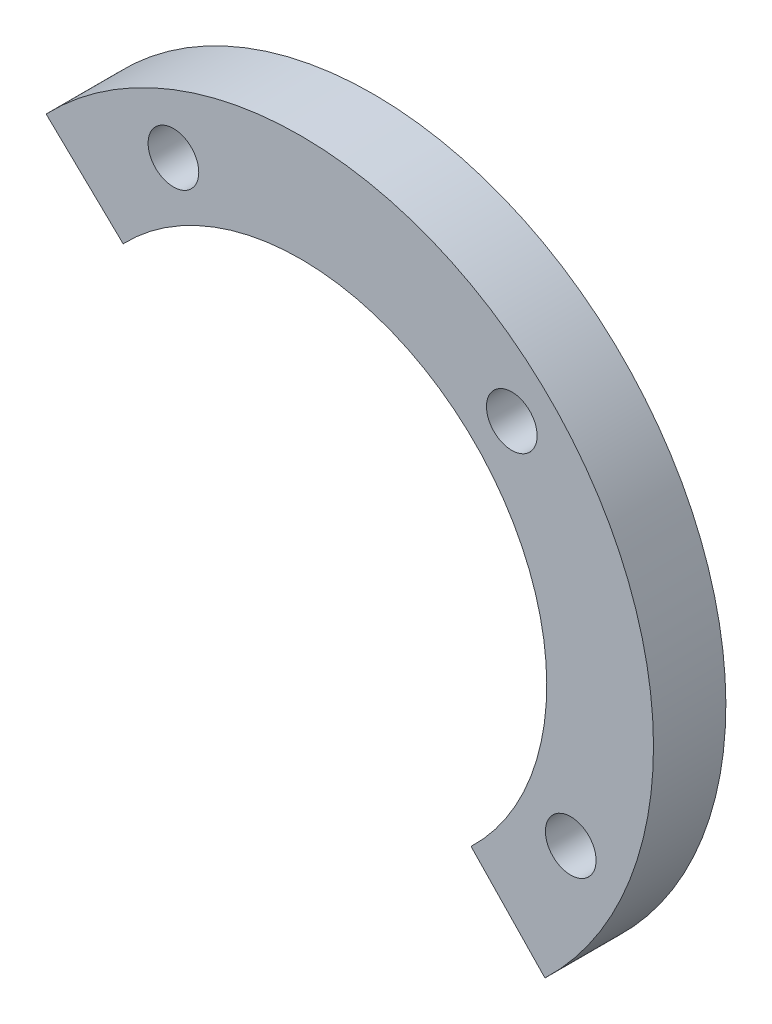
from build123d import *

# Parameters (mm, degrees)
SKETCH1_R      = 1.4
SHAPE_DEPTH    = 4
SKETCH2_R      = 1
NUT_CUTS_DEPTH = 2


with BuildPart() as part:
    # Sketch1 → Shape (new body)
    with BuildSketch(Plane.XY):
        with BuildLine():
            Line((74.415384615, 55.186207026), (78.5, 50.928752721))
            ThreePointArc((78.5, 50.928752721), (78.788582233, 78.788582233), (50.928752721, 78.5))
            Line((50.928752721, 78.5), (55.186207026, 74.415384615))
            ThreePointArc((55.186207026, 74.415384615), (70.07407211, 77.617994778), (78.6, 65))
            ThreePointArc((78.6, 65), (77.51018047, 59.665641124), (74.415384615, 55.186207026))
        make_face()
        with Locations((79.925281419, 57.965373175)):
            Circle(SKETCH1_R, mode=Mode.SUBTRACT)
        with Locations((57.965373175, 79.925281419)):
            Circle(SKETCH1_R, mode=Mode.SUBTRACT)
        with Locations((76.66726189, 76.66726189)):
            Circle(SKETCH1_R, mode=Mode.SUBTRACT)
    extrude(amount=SHAPE_DEPTH)

    # Sketch2 → Nut cuts (cut)
    with BuildSketch(Plane.XY):
        with Locations((56.258688641, 79.120881926)):
            Circle(SKETCH2_R)
        with Locations((56.415400513, 81.001113835)):
            Circle(SKETCH2_R)
        with Locations((58.122085046, 81.805513328)):
            Circle(SKETCH2_R)
        with Locations((59.672057709, 80.729680912)):
            Circle(SKETCH2_R)
        with Locations((59.515345837, 78.849449003)):
            Circle(SKETCH2_R)
        with Locations((57.808661304, 78.04504951)):
            Circle(SKETCH2_R)
        Polygon((60.576620219, 81.156021931), (58.205144148, 82.802057951), (55.593897104, 81.571317438), (55.354126131, 78.694540907), (57.725602202, 77.048504887), (60.336849246, 78.2792454), align=None)
    extrude(amount=NUT_CUTS_DEPTH, mode=Mode.SUBTRACT)


solid = part.part
